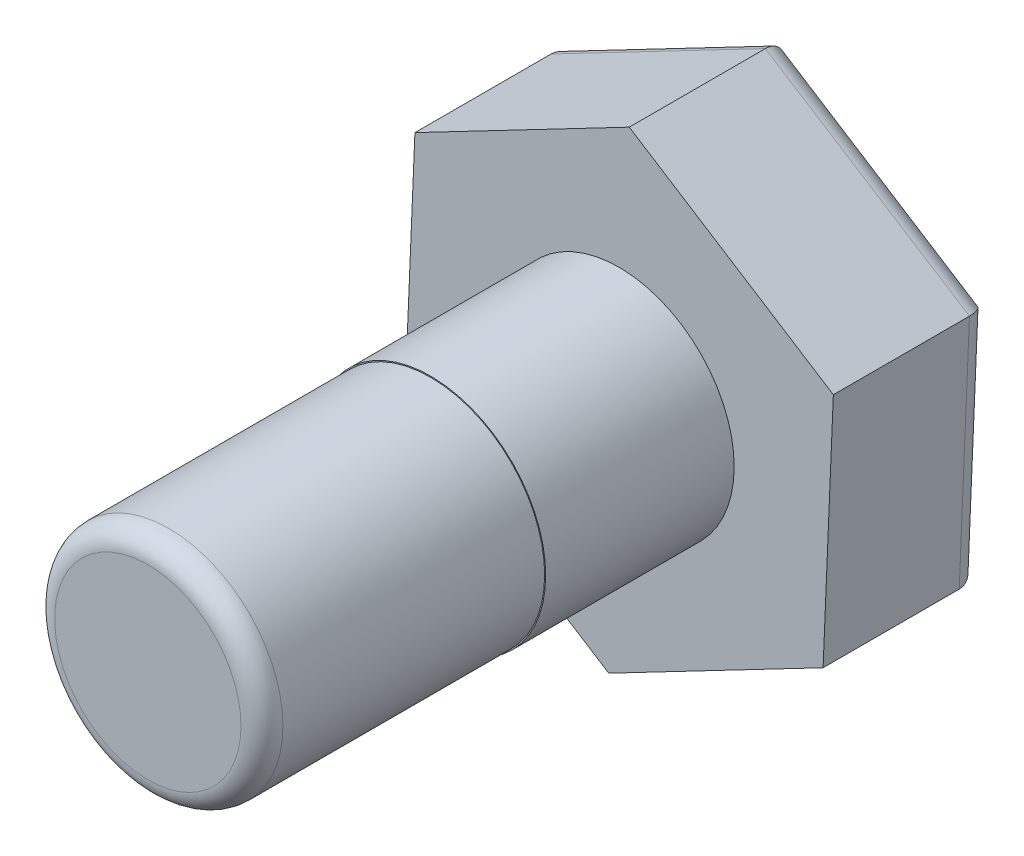
from build123d import *

# Parameters (mm, degrees)
EXTRUDE_309_DEPTH = 15
SKETCH_2_R        = 11
EXTRUDE_1_DEPTH   = 18
FILLET_3_R        = 2
SKETCH_3_R        = 10.9
EXTRUDE_1_2_DEPTH = 27
FILLET_4_R        = 2


with BuildPart() as part:
    # 草图1 → Extrude 309 (new body)
    with BuildSketch(Plane.XY):
        Polygon((20.472392036, 10.687118304), (0.980880074, 23.073170732), (-19.491511963, 12.386052428), (-20.472392036, -10.687118304), (-0.980880074, -23.073170732), (19.491511963, -12.386052428), align=None)
    extrude(amount=EXTRUDE_309_DEPTH)

    # 草图2 → Extrude 1 (add)
    with BuildSketch(Plane.XY.offset(15)):
        Circle(SKETCH_2_R)
    extrude(amount=EXTRUDE_1_DEPTH)

    # 圆角3
    fillet_3_edges = [part.edges().sort_by_distance(p)[0] for p in [
        (9.255315945, -17.72961158, 0),
        (-10.726636055, -16.880144518, 0),
        (-19.981952, 0.849467062, 0),
        (-9.255315945, 17.72961158, 0),
        (10.726636055, 16.880144518, 0),
        (19.981952, -0.849467062, 0),
    ]]
    fillet(fillet_3_edges, radius=FILLET_3_R)

    # 草图3 → Extrude 1 2 (add)
    with BuildSketch(Plane.XY.offset(33)):
        Circle(SKETCH_3_R)
    extrude(amount=EXTRUDE_1_2_DEPTH)

    # 圆角4
    fillet_4_edges = [part.edges().sort_by_distance(p)[0] for p in [
        (-10.9, 0, 60),
    ]]
    fillet(fillet_4_edges, radius=FILLET_4_R)


solid = part.part
